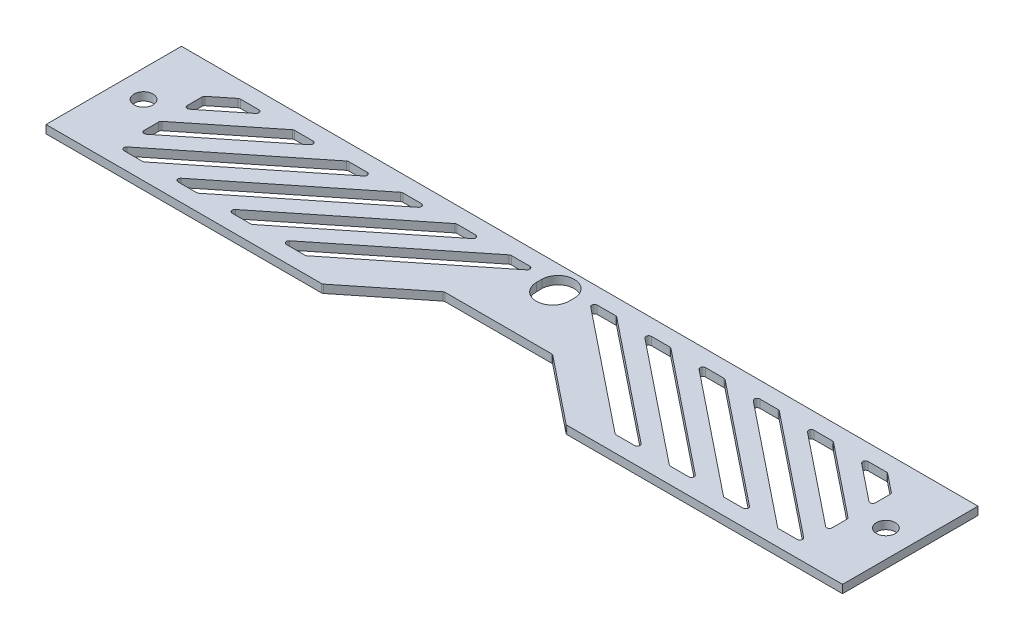
from build123d import *

# Parameters (mm, degrees)
SKETCH_1_W          = 147
SKETCH_1_H          = 25
EXTRUDE_1_DEPTH     = 1.5
CUT_EXTRUDE_1_DEPTH = 75.570436501
CUT_EXTRUDE_2_DEPTH = 10
FILLET_2_R          = 0.5
SKETCH_4_W          = 10
SKETCH_4_H          = 25
EXTRUDE_2_DEPTH     = 1.5
FILLET_3_R          = 0.5
SKETCH_5_R          = 1.75
CUT_EXTRUDE_3_DEPTH = 75.570436501
CUT_EXTRUDE_4_DEPTH = 75.570436501


with BuildPart() as part:
    # 草图1 → 凸台-拉伸1 (new body)
    with BuildSketch(Plane(origin=(0, 0, 0), x_dir=(1, 0, 0), z_dir=(0, 1, 0))):
        Rectangle(SKETCH_1_W, SKETCH_1_H)
    extrude(amount=EXTRUDE_1_DEPTH)

    # 草图2 → 切除-拉伸1 (cut, through all)
    with BuildSketch(Plane.XZ):
        Polygon((10, 2.5), (-10, 2.5), (-22.5, 12.5), (22.5, 12.5), align=None)
    extrude(amount=-CUT_EXTRUDE_1_DEPTH, mode=Mode.SUBTRACT)

    # 草图3 → 切除-拉伸2 (cut)
    with BuildSketch(Plane.XZ):
        Polygon((-4.802343178, -9.5), (-16.052343178, -0.5), (-28.552343178, 9.5), (-33.552343178, 9.5), (-21.052343178, -0.5), (-9.802343178, -9.5), align=None)
        Polygon((-26.052343178, -0.5), (-38.552343178, 9.5), (-43.552343178, 9.5), (-31.052343178, -0.5), (-19.802343178, -9.5), (-14.802343178, -9.5), align=None)
        Polygon((-36.052343178, -0.5), (-48.552343178, 9.5), (-53.552343178, 9.5), (-41.052343178, -0.5), (-29.802343178, -9.5), (-24.802343178, -9.5), align=None)
        Polygon((-46.052343178, -0.5), (-58.552343178, 9.5), (-63.552343178, 9.5), (-51.052343178, -0.5), (-39.802343178, -9.5), (-34.802343178, -9.5), align=None)
        Polygon((-56.052343178, -0.5), (-68.552343178, 9.5), (-70.5, 9.5), (-70.5, 7.058125458), (-61.052343178, -0.5), (-49.802343178, -9.5), (-44.802343178, -9.5), align=None)
        Polygon((-59.802343178, -9.5), (-54.802343178, -9.5), (-66.052343178, -0.5), (-70.5, 3.058125458), (-70.5, -0.941874542), align=None)
        Polygon((-70.5, -9.5), (-64.802343178, -9.5), (-70.5, -4.941874542), align=None)
    cut_extrude_2 = extrude(amount=-CUT_EXTRUDE_2_DEPTH, mode=Mode.SUBTRACT)

    # 镜向3: 切除-拉伸2 across plane
    add(cut_extrude_2.mirror(Plane(origin=(0, 0, 0), x_dir=(0, 0, 1), z_dir=(1, 0, 0))), mode=Mode.SUBTRACT)

    # 圆角2
    fillet_2_edges = [part.edges().sort_by_distance(p)[0] for p in [
        (-70.5, 0.75, -0.941874542),
        (-70.5, 0.75, 3.058125458),
        (-54.802343178, 0.75, -9.5),
        (-59.802343178, 0.75, -9.5),
        (-9.802343178, 0.75, -9.5),
        (-33.552343178, 0.75, 9.5),
        (-28.552343178, 0.75, 9.5),
        (-4.802343178, 0.75, -9.5),
        (22.5, 0.75, 12.5),
        (10, 0.75, 2.5),
        (-10, 0.75, 2.5),
        (-22.5, 0.75, 12.5),
        (63.552343178, 0.75, 9.5),
        (39.802343178, 0.75, -9.5),
        (34.802343178, 0.75, -9.5),
        (58.552343178, 0.75, 9.5),
        (70.5, 0.75, 7.058125458),
        (49.802343178, 0.75, -9.5),
        (44.802343178, 0.75, -9.5),
        (68.552343178, 0.75, 9.5),
        (70.5, 0.75, 9.5),
        (43.552343178, 0.75, 9.5),
        (19.802343178, 0.75, -9.5),
        (14.802343178, 0.75, -9.5),
        (38.552343178, 0.75, 9.5),
        (53.552343178, 0.75, 9.5),
        (29.802343178, 0.75, -9.5),
        (24.802343178, 0.75, -9.5),
        (48.552343178, 0.75, 9.5),
        (64.802343178, 0.75, -9.5),
        (70.5, 0.75, -4.941874542),
        (70.5, 0.75, -9.5),
        (70.5, 0.75, 3.058125458),
        (70.5, 0.75, -0.941874542),
        (59.802343178, 0.75, -9.5),
        (54.802343178, 0.75, -9.5),
        (33.552343178, 0.75, 9.5),
        (9.802343178, 0.75, -9.5),
        (4.802343178, 0.75, -9.5),
        (28.552343178, 0.75, 9.5),
        (-39.802343178, 0.75, -9.5),
        (-63.552343178, 0.75, 9.5),
        (-58.552343178, 0.75, 9.5),
        (-34.802343178, 0.75, -9.5),
        (-49.802343178, 0.75, -9.5),
        (-70.5, 0.75, 7.058125458),
        (-70.5, 0.75, 9.5),
        (-68.552343178, 0.75, 9.5),
        (-44.802343178, 0.75, -9.5),
        (73.5, 0.75, 12.5),
        (-19.802343178, 0.75, -9.5),
        (-73.5, 0.75, 12.5),
        (-43.552343178, 0.75, 9.5),
        (-38.552343178, 0.75, 9.5),
        (-14.802343178, 0.75, -9.5),
        (-73.5, 0.75, -12.5),
        (73.5, 0.75, -12.5),
        (-29.802343178, 0.75, -9.5),
        (-53.552343178, 0.75, 9.5),
        (-48.552343178, 0.75, 9.5),
        (-24.802343178, 0.75, -9.5),
        (-70.5, 0.75, -4.941874542),
        (-64.802343178, 0.75, -9.5),
        (-70.5, 0.75, -9.5),
    ]]
    fillet(fillet_2_edges, radius=FILLET_2_R)

    # 草图4 → 凸台-拉伸2 (add)
    with BuildSketch(Plane(origin=(0, 1.5, 0), x_dir=(1, 0, 0), z_dir=(0, 1, 0))):
        with Locations((68.5, 0)):
            Rectangle(SKETCH_4_W, SKETCH_4_H)
    extrude_2 = extrude(amount=-EXTRUDE_2_DEPTH)

    # 镜向4: 凸台-拉伸2 across plane
    add(extrude_2.mirror(Plane(origin=(0, 0, 0), x_dir=(0, 0, 1), z_dir=(1, 0, 0))))

    # 圆角3
    fillet_3_edges = [part.edges().sort_by_distance(p)[0] for p in [
        (63.5, 0.75, 5.458125458),
        (63.5, 0.75, -6.541874542),
        (63.5, 0.75, -2.541874542),
        (63.5, 0.75, 1.458125458),
        (-63.5, 0.75, 5.458125458),
        (-63.5, 0.75, -2.541874542),
        (-63.5, 0.75, 1.458125458),
        (-63.5, 0.75, -6.541874542),
    ]]
    fillet(fillet_3_edges, radius=FILLET_3_R)

    # 草图5 → 切除-拉伸3 (cut, through all)
    with BuildSketch(Plane.XZ):
        with Locations(Location((-68.5, -0.5, 0), (0, 0, 270))):
            Circle(SKETCH_5_R)
        with Locations(Location((68.5, -0.5, 0), (0, 0, 270))):
            Circle(SKETCH_5_R)
    extrude(amount=-CUT_EXTRUDE_3_DEPTH, mode=Mode.SUBTRACT)

    # 草图6 → 切除-拉伸4 (cut, through all)
    with BuildSketch(Plane(origin=(0, 1.5, 0), x_dir=(1, 0, 0), z_dir=(0, 1, 0))):
        with BuildLine():
            Line((3, 8.5), (3, 7.5))
            ThreePointArc((3, 7.5), (0, 4.5), (-3, 7.5))
            Line((-3, 7.5), (-3, 8.5))
            ThreePointArc((-3, 8.5), (0, 11.5), (3, 8.5))
        make_face()
    extrude(amount=-CUT_EXTRUDE_4_DEPTH, mode=Mode.SUBTRACT)


solid = part.part
